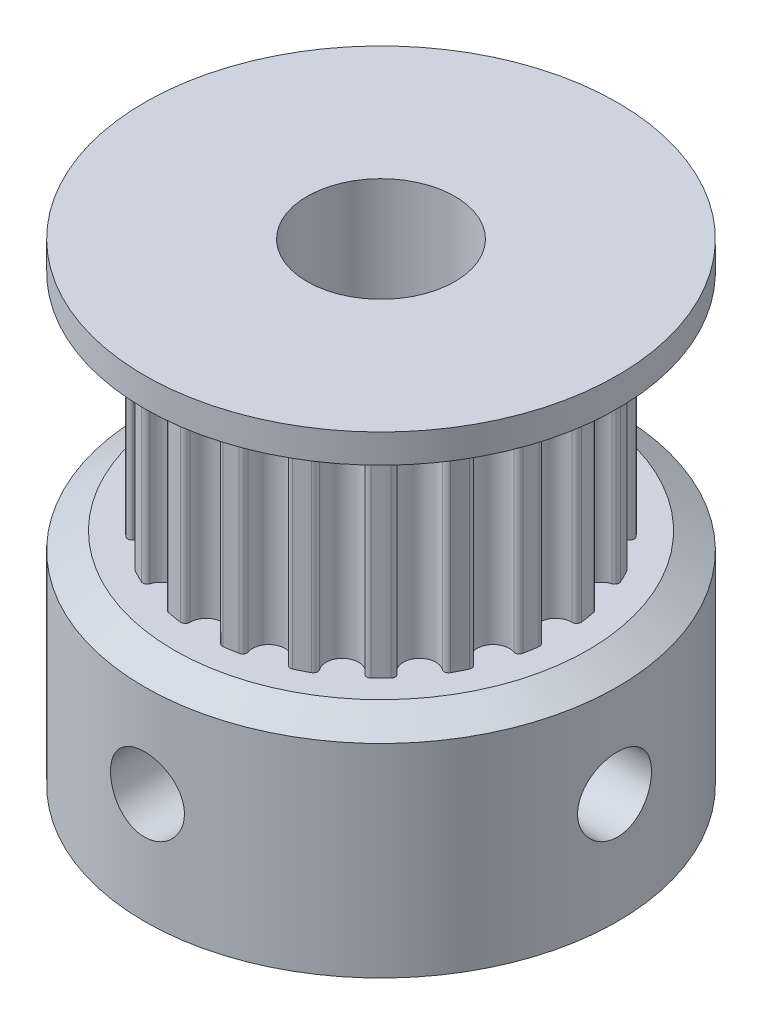
from build123d import *
from OCP.BRepFilletAPI import BRepFilletAPI_MakeChamfer

# Parameters (mm, degrees)
SKETCH_1_R               = 8
SKETCH_1_R_2             = 2.5
EXTRUDE_1_DEPTH          = 7.45
SKETCH_2_R               = 2.5
EXTRUDE_2_DEPTH          = 7
SKETCH_3_R               = 8
SKETCH_3_R_2             = 2.5
EXTRUDE_3_DEPTH          = 1.55
CUT_EXTRUDE_1_REACH      = 21.596
CUT_EXTRUDE_1_END_RADIUS = 8
SKETCH_4_R               = 1.25
CUT_EXTRUDE_2_REACH      = 21.596
CUT_EXTRUDE_2_END_RADIUS = 8
SKETCH_5_R               = 1.25
CHAMFER_1_SIZE           = 1
CHAMFER_1_SIZE2          = 0.577350269


with BuildPart() as part:
    # Эскиз1 → Бобышка-Вытянуть1 (new body)
    with BuildSketch(Plane(origin=(0, 0, 0), x_dir=(1, 0, 0), z_dir=(0, 1, 0))):
        with Locations(Location((0, 0, 0), (0, 0, 270))):
            Circle(SKETCH_1_R)
        with Locations(Location((0, 0, 0), (0, 0, 270))):
            Circle(SKETCH_1_R_2, mode=Mode.SUBTRACT)
    extrude(amount=EXTRUDE_1_DEPTH)

    # Эскиз2 → Бобышка-Вытянуть2 (add)
    with BuildSketch(Plane(origin=(0, 7.45, 0), x_dir=(1, 0, 0), z_dir=(0, 1, 0))):
        with BuildLine():
            ThreePointArc((-2.557469435, 5.549004423), (-2.773881953, 5.444049863), (-2.985996064, 5.3306592))
            ThreePointArc((-2.985996064, 5.3306592), (-3.059404709, 5.231014138), (-3.032930262, 5.110113057))
            ThreePointArc((-3.032930262, 5.110113057), (-3.150528952, 4.33633109), (-3.922779328, 4.463599867))
            ThreePointArc((-3.922779328, 4.463599867), (-4.029582035, 4.526139051), (-4.14703464, 4.487115298))
            ThreePointArc((-4.14703464, 4.487115298), (-4.320422433, 4.320422433), (-4.487115298, 4.14703464))
            ThreePointArc((-4.487115298, 4.14703464), (-4.526139051, 4.029582035), (-4.463599867, 3.922779328))
            ThreePointArc((-4.463599867, 3.922779328), (-4.33633109, 3.150528952), (-5.110113057, 3.032930262))
            ThreePointArc((-5.110113057, 3.032930262), (-5.231014138, 3.059404709), (-5.3306592, 2.985996064))
            ThreePointArc((-5.3306592, 2.985996064), (-5.444049863, 2.773881953), (-5.549004423, 2.557469435))
            ThreePointArc((-5.549004423, 2.557469435), (-5.549823367, 2.433706366), (-5.457341217, 2.351456627))
            ThreePointArc((-5.457341217, 2.351456627), (-5.097662927, 1.65633109), (-5.797233315, 1.305376312))
            ThreePointArc((-5.797233315, 1.305376312), (-5.92039813, 1.293194518), (-5.992481697, 1.19258673))
            ThreePointArc((-5.992481697, 1.19258673), (-6.034775761, 0.955814581), (-6.067718334, 0.717561302))
            ThreePointArc((-6.067718334, 0.717561302), (-6.030252304, 0.599602562), (-5.916879985, 0.549956967))
            ThreePointArc((-5.916879985, 0.549956967), (-5.36, 0), (-5.916879985, -0.549956967))
            ThreePointArc((-5.916879985, -0.549956967), (-6.030252304, -0.599602562), (-6.067718334, -0.717561302))
            ThreePointArc((-6.067718334, -0.717561302), (-6.034775761, -0.955814581), (-5.992481697, -1.19258673))
            ThreePointArc((-5.992481697, -1.19258673), (-5.92039813, -1.293194518), (-5.797233315, -1.305376312))
            ThreePointArc((-5.797233315, -1.305376312), (-5.097662927, -1.65633109), (-5.457341217, -2.351456627))
            ThreePointArc((-5.457341217, -2.351456627), (-5.549823367, -2.433706366), (-5.549004423, -2.557469435))
            ThreePointArc((-5.549004423, -2.557469435), (-5.444049863, -2.773881953), (-5.3306592, -2.985996064))
            ThreePointArc((-5.3306592, -2.985996064), (-5.231014138, -3.059404709), (-5.110113057, -3.032930262))
            ThreePointArc((-5.110113057, -3.032930262), (-4.33633109, -3.150528952), (-4.463599867, -3.922779328))
            ThreePointArc((-4.463599867, -3.922779328), (-4.526139051, -4.029582035), (-4.487115298, -4.14703464))
            ThreePointArc((-4.487115298, -4.14703464), (-4.320422433, -4.320422433), (-4.14703464, -4.487115298))
            ThreePointArc((-4.14703464, -4.487115298), (-4.029582035, -4.526139051), (-3.922779328, -4.463599867))
            ThreePointArc((-3.922779328, -4.463599867), (-3.150528952, -4.33633109), (-3.032930262, -5.110113057))
            ThreePointArc((-3.032930262, -5.110113057), (-3.059404709, -5.231014138), (-2.985996064, -5.3306592))
            ThreePointArc((-2.985996064, -5.3306592), (-2.773881953, -5.444049863), (-2.557469435, -5.549004423))
            ThreePointArc((-2.557469435, -5.549004423), (-2.433706366, -5.549823367), (-2.351456627, -5.457341217))
            ThreePointArc((-2.351456627, -5.457341217), (-1.65633109, -5.097662927), (-1.305376312, -5.797233315))
            ThreePointArc((-1.305376312, -5.797233315), (-1.293194518, -5.92039813), (-1.19258673, -5.992481697))
            ThreePointArc((-1.19258673, -5.992481697), (-0.955814581, -6.034775761), (-0.717561302, -6.067718334))
            ThreePointArc((-0.717561302, -6.067718334), (-0.599602562, -6.030252304), (-0.549956967, -5.916879985))
            ThreePointArc((-0.549956967, -5.916879985), (0, -5.36), (0.549956967, -5.916879985))
            ThreePointArc((0.549956967, -5.916879985), (0.599602562, -6.030252304), (0.717561302, -6.067718334))
            ThreePointArc((0.717561302, -6.067718334), (0.955814581, -6.034775761), (1.19258673, -5.992481697))
            ThreePointArc((1.19258673, -5.992481697), (1.293194518, -5.92039813), (1.305376312, -5.797233315))
            ThreePointArc((1.305376312, -5.797233315), (1.65633109, -5.097662927), (2.351456627, -5.457341217))
            ThreePointArc((2.351456627, -5.457341217), (2.433706366, -5.549823367), (2.557469435, -5.549004423))
            ThreePointArc((2.557469435, -5.549004423), (2.773881953, -5.444049863), (2.985996064, -5.3306592))
            ThreePointArc((2.985996064, -5.3306592), (3.059404709, -5.231014138), (3.032930262, -5.110113057))
            ThreePointArc((3.032930262, -5.110113057), (3.150528952, -4.33633109), (3.922779328, -4.463599867))
            ThreePointArc((3.922779328, -4.463599867), (4.029582035, -4.526139051), (4.14703464, -4.487115298))
            ThreePointArc((4.14703464, -4.487115298), (4.320422433, -4.320422433), (4.487115298, -4.14703464))
            ThreePointArc((4.487115298, -4.14703464), (4.526139051, -4.029582035), (4.463599867, -3.922779328))
            ThreePointArc((4.463599867, -3.922779328), (4.33633109, -3.150528952), (5.110113057, -3.032930262))
            ThreePointArc((5.110113057, -3.032930262), (5.231014138, -3.059404709), (5.3306592, -2.985996064))
            ThreePointArc((5.3306592, -2.985996064), (5.444049863, -2.773881953), (5.549004423, -2.557469435))
            ThreePointArc((5.549004423, -2.557469435), (5.549823367, -2.433706366), (5.457341217, -2.351456627))
            ThreePointArc((5.457341217, -2.351456627), (5.097662927, -1.65633109), (5.797233315, -1.305376312))
            ThreePointArc((5.797233315, -1.305376312), (5.92039813, -1.293194518), (5.992481697, -1.19258673))
            ThreePointArc((5.992481697, -1.19258673), (6.034775761, -0.955814581), (6.067718334, -0.717561302))
            ThreePointArc((6.067718334, -0.717561302), (6.030252304, -0.599602562), (5.916879985, -0.549956967))
            ThreePointArc((5.916879985, -0.549956967), (5.36, 0), (5.916879985, 0.549956967))
            ThreePointArc((5.916879985, 0.549956967), (6.030252304, 0.599602562), (6.067718334, 0.717561302))
            ThreePointArc((6.067718334, 0.717561302), (6.034775761, 0.955814581), (5.992481697, 1.19258673))
            ThreePointArc((5.992481697, 1.19258673), (5.92039813, 1.293194518), (5.797233315, 1.305376312))
            ThreePointArc((5.797233315, 1.305376312), (5.097662927, 1.65633109), (5.457341217, 2.351456627))
            ThreePointArc((5.457341217, 2.351456627), (5.549823367, 2.433706366), (5.549004423, 2.557469435))
            ThreePointArc((5.549004423, 2.557469435), (5.444049863, 2.773881953), (5.3306592, 2.985996064))
            ThreePointArc((5.3306592, 2.985996064), (5.231014138, 3.059404709), (5.110113057, 3.032930262))
            ThreePointArc((5.110113057, 3.032930262), (4.33633109, 3.150528952), (4.463599867, 3.922779328))
            ThreePointArc((4.463599867, 3.922779328), (4.526139051, 4.029582035), (4.487115298, 4.14703464))
            ThreePointArc((4.487115298, 4.14703464), (4.320422433, 4.320422433), (4.14703464, 4.487115298))
            ThreePointArc((4.14703464, 4.487115298), (4.029582035, 4.526139051), (3.922779328, 4.463599867))
            ThreePointArc((3.922779328, 4.463599867), (3.150528952, 4.33633109), (3.032930262, 5.110113057))
            ThreePointArc((3.032930262, 5.110113057), (3.059404709, 5.231014138), (2.985996064, 5.3306592))
            ThreePointArc((2.985996064, 5.3306592), (2.773881953, 5.444049863), (2.557469435, 5.549004423))
            ThreePointArc((2.557469435, 5.549004423), (2.433706366, 5.549823367), (2.351456627, 5.457341217))
            ThreePointArc((2.351456627, 5.457341217), (1.65633109, 5.097662927), (1.305376312, 5.797233315))
            ThreePointArc((1.305376312, 5.797233315), (1.293194518, 5.92039813), (1.19258673, 5.992481697))
            ThreePointArc((1.19258673, 5.992481697), (0.955814581, 6.034775761), (0.717561302, 6.067718334))
            ThreePointArc((0.717561302, 6.067718334), (0.599602562, 6.030252304), (0.549956967, 5.916879985))
            ThreePointArc((0.549956967, 5.916879985), (0, 5.36), (-0.549956967, 5.916879985))
            ThreePointArc((-0.549956967, 5.916879985), (-0.599602562, 6.030252304), (-0.717561302, 6.067718334))
            ThreePointArc((-0.717561302, 6.067718334), (-0.955814581, 6.034775761), (-1.19258673, 5.992481697))
            ThreePointArc((-1.19258673, 5.992481697), (-1.293194518, 5.92039813), (-1.305376312, 5.797233315))
            ThreePointArc((-1.305376312, 5.797233315), (-1.65633109, 5.097662927), (-2.351456627, 5.457341217))
            ThreePointArc((-2.351456627, 5.457341217), (-2.433706366, 5.549823367), (-2.557469435, 5.549004423))
        make_face()
        with Locations(Location((0, 0, 0), (0, 0, 270))):
            Circle(SKETCH_2_R, mode=Mode.SUBTRACT)
    extrude(amount=EXTRUDE_2_DEPTH)

    # Эскиз3 → Бобышка-Вытянуть3 (add)
    with BuildSketch(Plane(origin=(0, 14.45, 0), x_dir=(1, 0, 0), z_dir=(0, 1, 0))):
        with Locations(Location((0, 0, 0), (0, 0, 270))):
            Circle(SKETCH_3_R)
        with Locations(Location((0, 0, 0), (0, 0, 270))):
            Circle(SKETCH_3_R_2, mode=Mode.SUBTRACT)
    extrude(amount=EXTRUDE_3_DEPTH)

    # Вырез-Вытянуть1: up to this cylinder (the profile starts inside it)
    cut_extrude_1_end = Plane(origin=(0, 3.725, 0), z_dir=(0, -1, 0)) * Cylinder(CUT_EXTRUDE_1_END_RADIUS, 60.192, mode=Mode.PRIVATE)
    # Эскиз4 → Вырез-Вытянуть1 (cut, up to the surface)
    with BuildSketch(Plane.XY, mode=Mode.PRIVATE) as cut_extrude_1_sk1:
        with Locations(Location((0, 3.725, 0), (0, 0, 180))):
            Circle(SKETCH_4_R)
    cut_extrude_1_tool1 = extrude(cut_extrude_1_sk1.sketch, amount=CUT_EXTRUDE_1_REACH, mode=Mode.PRIVATE) & cut_extrude_1_end
    add(cut_extrude_1_tool1.solids().sort_by_distance((0, 3.725, 0))[0], mode=Mode.SUBTRACT)

    # Вырез-Вытянуть2: up to this cylinder (the profile starts inside it)
    cut_extrude_2_end = Plane(origin=(0, 3.725, 0), z_dir=(0, -1, 0)) * Cylinder(CUT_EXTRUDE_2_END_RADIUS, 60.192, mode=Mode.PRIVATE)
    # Эскиз5 → Вырез-Вытянуть2 (cut, up to the surface)
    with BuildSketch(Plane(origin=(0, 0, 0), x_dir=(0, 0, -1), z_dir=(1, 0, 0)), mode=Mode.PRIVATE) as cut_extrude_2_sk1:
        with Locations(Location((0, 3.725, 0), (0, 0, 180))):
            Circle(SKETCH_5_R)
    cut_extrude_2_tool1 = extrude(cut_extrude_2_sk1.sketch, amount=CUT_EXTRUDE_2_REACH, mode=Mode.PRIVATE) & cut_extrude_2_end
    add(cut_extrude_2_tool1.solids().sort_by_distance((0, 3.725, 0))[0], mode=Mode.SUBTRACT)

    # Фаска1: one chamfer whose edges measure the first distance from different faces: ONE call of the kernel's chamfer builder (chamfer() names one face for all edges)
    chamfer_1_edges_1 = [part.edges().sort_by_distance(p)[0] for p in [
        (0, 14.45, -8),
    ]]
    chamfer_1_side_1 = [part.faces().sort_by_distance(p)[0] for p in [
        (0, 14.45, -7.77372583),
    ]]
    chamfer_1_edges_2 = [part.edges().sort_by_distance(p)[0] for p in [
        (0, 7.45, -8),
    ]]
    chamfer_1_side_2 = [part.faces().sort_by_distance(p)[0] for p in [
        (0, 7.45, -7.77372583),
    ]]
    chamfer_1 = BRepFilletAPI_MakeChamfer(part.part.solid().wrapped)
    for e in chamfer_1_edges_1:
        chamfer_1.Add(CHAMFER_1_SIZE, CHAMFER_1_SIZE2, e.wrapped, chamfer_1_side_1[0].wrapped)  # the first distance lies on this face
    for e in chamfer_1_edges_2:
        chamfer_1.Add(CHAMFER_1_SIZE, CHAMFER_1_SIZE2, e.wrapped, chamfer_1_side_2[0].wrapped)  # the first distance lies on this face
    add(Compound.cast(chamfer_1.Shape()), mode=Mode.REPLACE)


solid = part.part
